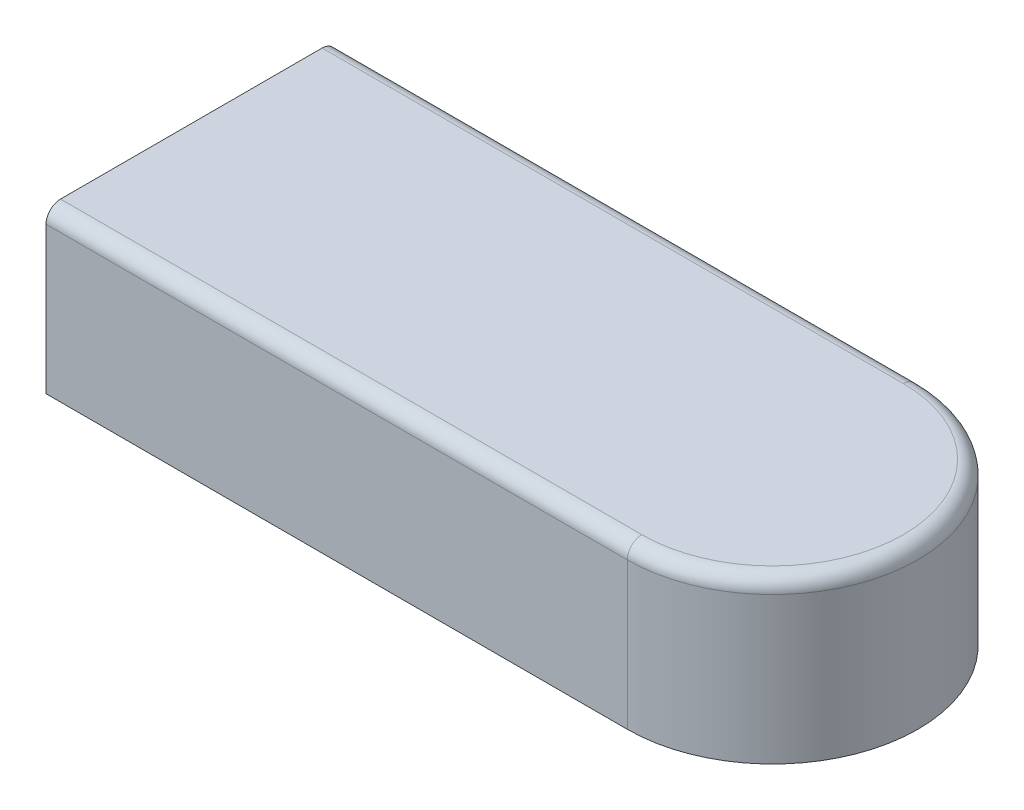
from build123d import *

# Parameters (mm, degrees)
BOSS_EXTRUDE2_DEPTH      = 25.4
BOSS_EXTRUDE2_DEPTH_BACK = 2.794
FILLET1_R                = 2.54


with BuildPart() as part:
    # Sketch1 → Boss-Extrude2 (new, two sides: drawn at the far end of the back side and taken through both)
    with BuildSketch(Plane(origin=(0, 0, 0), x_dir=(1, 0, 0), z_dir=(0, 1, 0)).offset(-BOSS_EXTRUDE2_DEPTH_BACK)):
        with BuildLine():
            Line((56.621204677, 38.330630999), (-44.978795323, 38.330630999))
            Line((-44.978795323, 38.330630999), (-44.978795323, -12.469369001))
            Line((-44.978795323, -12.469369001), (56.621204677, -12.469369001))
            ThreePointArc((56.621204677, -12.469369001), (82.021204677, 12.930630999), (56.621204677, 38.330630999))
        make_face()
    extrude(amount=BOSS_EXTRUDE2_DEPTH + BOSS_EXTRUDE2_DEPTH_BACK)

    # Fillet1
    fillet1_edges = [part.edges().sort_by_distance(p)[0] for p in [
        (5.821204677, 25.4, 12.469369001),
        (82.021204677, 25.4, -12.930630999),
        (5.821204677, 25.4, -38.330630999),
    ]]
    fillet(fillet1_edges, radius=FILLET1_R)


solid = part.part
